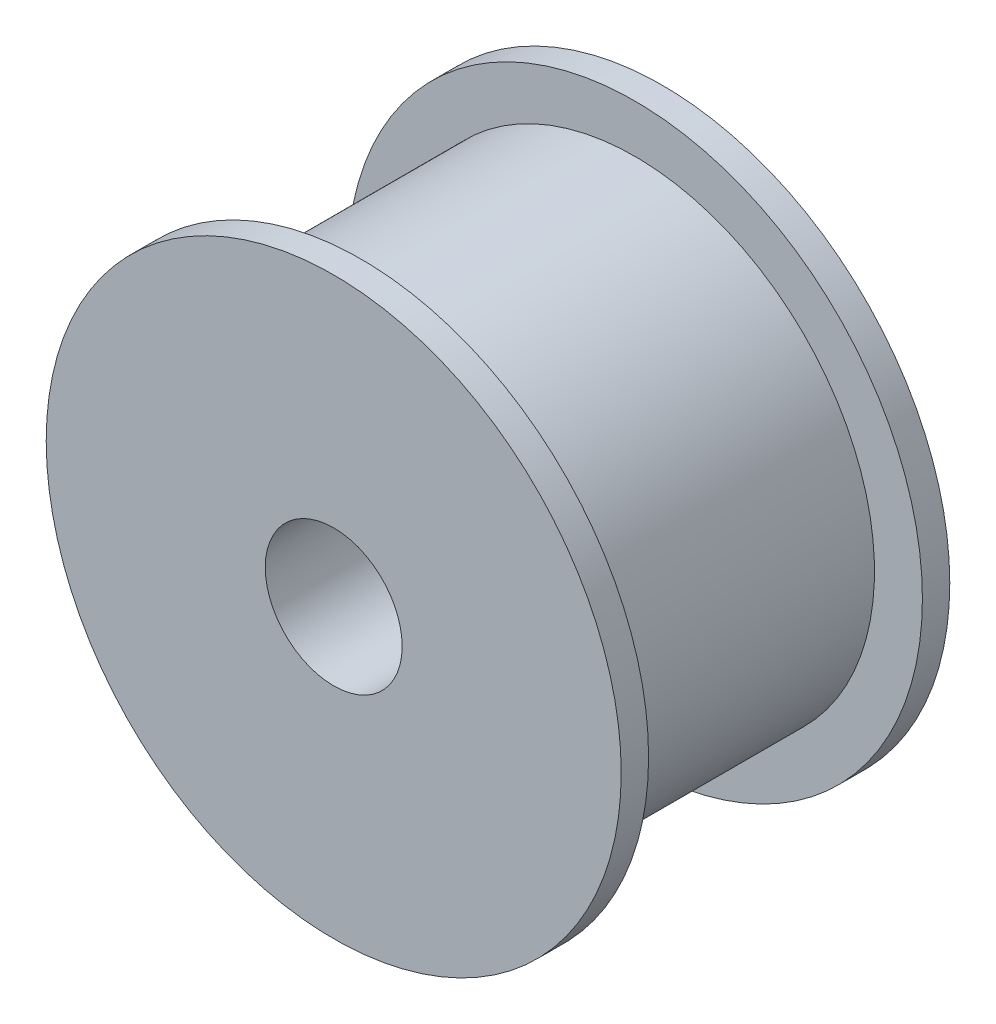
from build123d import *
from build123d.topology import SkipClean

# Parameters (mm, degrees)
ESQUISSE1_R        = 10.5
ESQUISSE1_R_2      = 2.5
BOSS_EXTRU_1_DEPTH = 1
BOSS_EXTRU_2_START = 10
ESQUISSE2_R        = 8.75
ESQUISSE2_R_2      = 2.5
BOSS_EXTRU_2_DEPTH = 10
BOSS_EXTRU_3_START = 1
ESQUISSE3_R        = 10.5
ESQUISSE3_R_2      = 2.5
BOSS_EXTRU_3_DEPTH = 1


with BuildPart() as part:
    # Esquisse1 → Boss.-Extru.1 (new body)
    with BuildSketch(Plane.XY):
        Circle(ESQUISSE1_R)
        Circle(ESQUISSE1_R_2, mode=Mode.SUBTRACT)
    extrude(amount=BOSS_EXTRU_1_DEPTH)

    # Esquisse2 → Boss.-Extru.2 (add)
    with SkipClean():  # the faces are left unmerged after this step: merging them gives an invalid solid
        with BuildSketch(Plane(origin=(0, 0, 0), x_dir=(-1, 0, 0), z_dir=(0, 0, -1)).offset(BOSS_EXTRU_2_START)):
            Circle(ESQUISSE2_R)
            Circle(ESQUISSE2_R_2, mode=Mode.SUBTRACT)
        extrude(amount=-BOSS_EXTRU_2_DEPTH)

    # Esquisse3 → Boss.-Extru.3 (add)
    with SkipClean():  # the faces are left unmerged after this step: merging them gives an invalid solid
        with BuildSketch(Plane(origin=(0, 0, -10), x_dir=(-1, 0, 0), z_dir=(0, 0, -1)).offset(BOSS_EXTRU_3_START)):
            with Locations(Location((0, 0, 0), (0, 0, 180))):
                Circle(ESQUISSE3_R)
            Circle(ESQUISSE3_R_2, mode=Mode.SUBTRACT)
        extrude(amount=-BOSS_EXTRU_3_DEPTH)


solid = part.part
